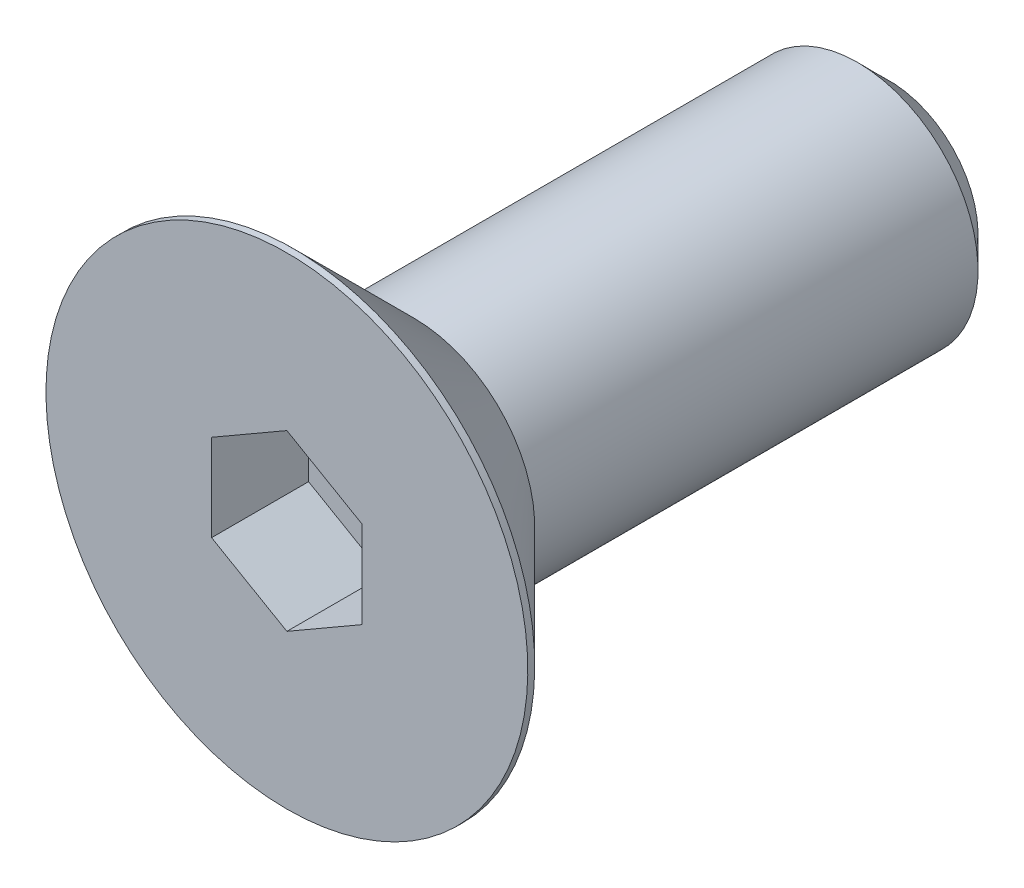
from build123d import *

# Parameters (mm, degrees)
CHAMFER1_SIZE      = 0.525
CUT_EXTRUDE2_DEPTH = 1.61


with BuildPart() as part:
    # Sketch1 → Revolve1 (revolve)
    with BuildSketch(Plane(origin=(0, 0, 0), x_dir=(0, 0, -1), z_dir=(1, 0, 0))):
        Polygon((-2.7, 2), (5, 2), (5, 0), (-3.39, 0), (-3.39, 2), align=None)
    revolve(axis=Axis((0, 0, 3.39), (0, 0, -1)))

    # Chamfer1
    chamfer1_edges = [part.edges().sort_by_distance(p)[0] for p in [
        (0, -2, -5),
    ]]
    chamfer(chamfer1_edges, length=CHAMFER1_SIZE)

    # Sketch7 → Revolve2 (revolve)
    with BuildSketch(Plane(origin=(0, 0, 0), x_dir=(0, 0, -1), z_dir=(1, 0, 0))):
        Polygon((-4.885, 4), (-5, 4), (-5, 0), (-2.7, 0), (-2.7, 1.815), align=None)
    revolve(axis=Axis((0, 0, 5), (0, 0, -1)))

    # Sketch5 → Cut-Extrude2 (cut)
    with BuildSketch(Plane.XY.offset(5)):
        Polygon((1.25, -0.721687836), (1.25, 0.721687836), (0, 1.443375673), (-1.25, 0.721687836), (-1.25, -0.721687836), (0, -1.443375673), align=None)
    extrude(amount=-CUT_EXTRUDE2_DEPTH, mode=Mode.SUBTRACT)


solid = part.part
